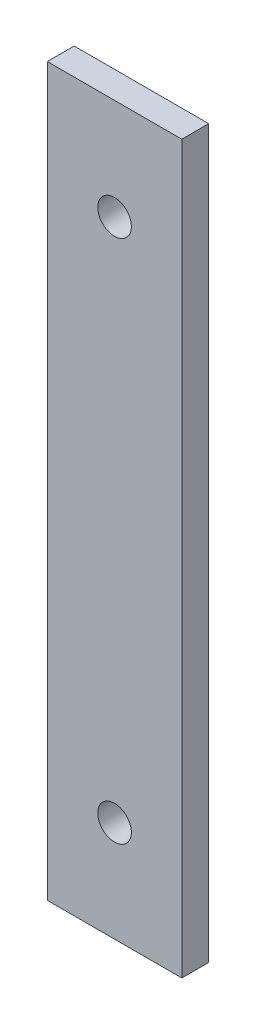
from build123d import *

# Parameters (mm, degrees)
SKETCH_1_W      = 10
SKETCH_1_H      = 54
SKETCH_1_R      = 1.25
EXTRUDE_1_DEPTH = 2


with BuildPart() as part:
    # 草圖1 → 填料-伸長1 (new body)
    with BuildSketch(Plane.XY):
        with Locations((-1.728982539, -13.134020619)):
            Rectangle(SKETCH_1_W, SKETCH_1_H)
        with Locations((-1.728982539, 6.365979381)):
            Circle(SKETCH_1_R, mode=Mode.SUBTRACT)
        with Locations((-1.728982539, -32.634020619)):
            Circle(SKETCH_1_R, mode=Mode.SUBTRACT)
    extrude(amount=EXTRUDE_1_DEPTH)


solid = part.part
